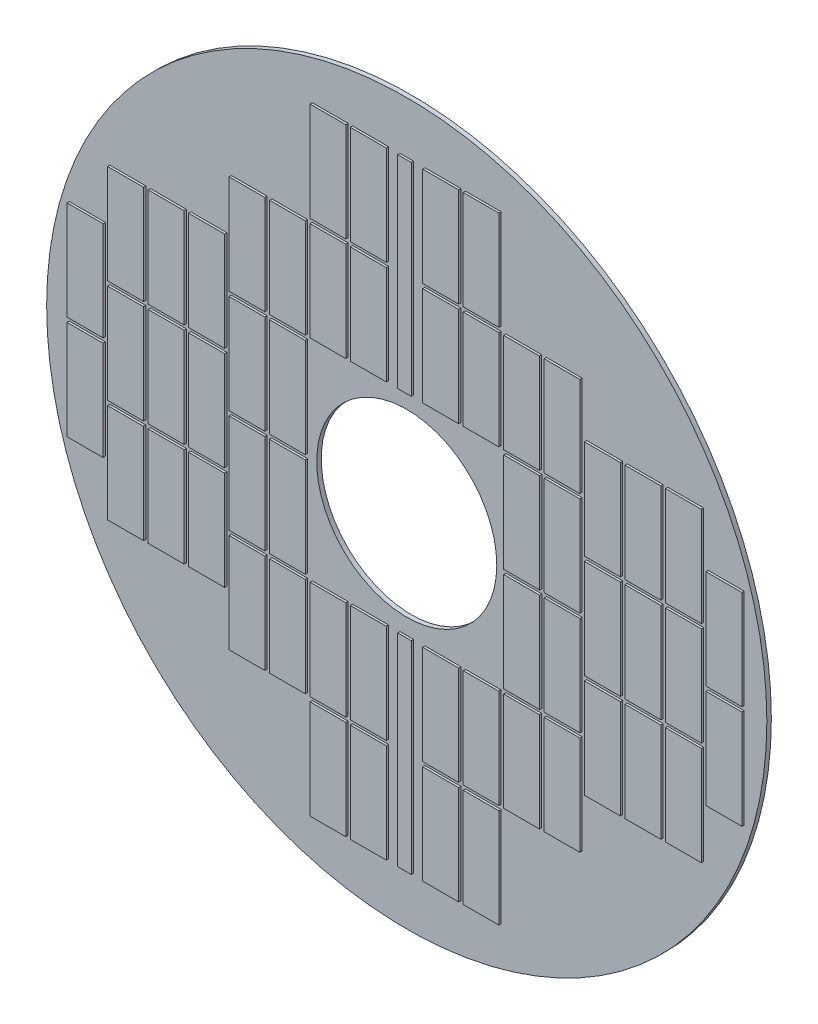
from build123d import *

# Parameters (mm, degrees)
SKETCH_1_R      = 800
SKETCH_1_R_2    = 200
EXTRUDE_1_DEPTH = 10
SKETCH_2_W      = 80
SKETCH_2_H      = 220
SKETCH_2_W_2    = 79.242685904
EXTRUDE_2_DEPTH = 15
SKETCH_3_W      = 30
SKETCH_3_H      = 450
EXTRUDE_3_DEPTH = 15


with BuildPart() as part:
    # 草图1 → 凸台-拉伸1 (new body)
    with BuildSketch(Plane.XY):
        Circle(SKETCH_1_R)
        Circle(SKETCH_1_R_2, mode=Mode.SUBTRACT)
    extrude(amount=EXTRUDE_1_DEPTH)

    # 草图2 → 凸台-拉伸2 (add)
    with BuildSketch(Plane.XY):
        with Locations((709.692901867, 115)):
            Rectangle(SKETCH_2_W, SKETCH_2_H)
        with Locations((619.692901867, 0)):
            Rectangle(SKETCH_2_W, SKETCH_2_H)
        with Locations((529.692901867, 0)):
            Rectangle(SKETCH_2_W, SKETCH_2_H)
        with Locations((439.692901867, 0)):
            Rectangle(SKETCH_2_W, SKETCH_2_H)
        with Locations((619.692901867, 230)):
            Rectangle(SKETCH_2_W, SKETCH_2_H)
        with Locations((529.692901867, 230)):
            Rectangle(SKETCH_2_W, SKETCH_2_H)
        with Locations((439.692901867, 230)):
            Rectangle(SKETCH_2_W, SKETCH_2_H)
        with Locations((350.071558915, 115)):
            Rectangle(SKETCH_2_W_2, SKETCH_2_H)
        with Locations((260.450215963, 115)):
            Rectangle(SKETCH_2_W, SKETCH_2_H)
        with Locations((350.071558915, 345)):
            Rectangle(SKETCH_2_W_2, SKETCH_2_H)
        with Locations((260.071558915, 345)):
            Rectangle(SKETCH_2_W_2, SKETCH_2_H)
        with Locations((170.071558915, 345)):
            Rectangle(SKETCH_2_W_2, SKETCH_2_H)
        with Locations((80.450215963, 345)):
            Rectangle(SKETCH_2_W, SKETCH_2_H)
        with Locations((170.071558915, 575)):
            Rectangle(SKETCH_2_W_2, SKETCH_2_H)
        with Locations((80.450215963, 575)):
            Rectangle(SKETCH_2_W, SKETCH_2_H)
        with Locations((170.071558915, -575)):
            Rectangle(SKETCH_2_W_2, SKETCH_2_H)
        with Locations((80.450215963, -575)):
            Rectangle(SKETCH_2_W, SKETCH_2_H)
        with Locations((80.450215963, -345)):
            Rectangle(SKETCH_2_W, SKETCH_2_H)
        with Locations((170.071558915, -345)):
            Rectangle(SKETCH_2_W_2, SKETCH_2_H)
        with Locations((260.071558915, -345)):
            Rectangle(SKETCH_2_W_2, SKETCH_2_H)
        with Locations((350.071558915, -345)):
            Rectangle(SKETCH_2_W_2, SKETCH_2_H)
        with Locations((709.692901867, -115)):
            Rectangle(SKETCH_2_W, SKETCH_2_H)
        with Locations((619.692901867, -230)):
            Rectangle(SKETCH_2_W, SKETCH_2_H)
        with Locations((529.692901867, -230)):
            Rectangle(SKETCH_2_W, SKETCH_2_H)
        with Locations((439.692901867, -230)):
            Rectangle(SKETCH_2_W, SKETCH_2_H)
        with Locations((350.071558915, -115)):
            Rectangle(SKETCH_2_W_2, SKETCH_2_H)
        with Locations((260.450215963, -115)):
            Rectangle(SKETCH_2_W, SKETCH_2_H)
        with Locations((-260.450215963, -115)):
            Rectangle(SKETCH_2_W, SKETCH_2_H)
        with Locations((-350.071558915, -115)):
            Rectangle(SKETCH_2_W_2, SKETCH_2_H)
        with Locations((-439.692901867, -230)):
            Rectangle(SKETCH_2_W, SKETCH_2_H)
        with Locations((-529.692901867, -230)):
            Rectangle(SKETCH_2_W, SKETCH_2_H)
        with Locations((-619.692901867, -230)):
            Rectangle(SKETCH_2_W, SKETCH_2_H)
        with Locations((-709.692901867, -115)):
            Rectangle(SKETCH_2_W, SKETCH_2_H)
        with Locations((-350.071558915, -345)):
            Rectangle(SKETCH_2_W_2, SKETCH_2_H)
        with Locations((-260.071558915, -345)):
            Rectangle(SKETCH_2_W_2, SKETCH_2_H)
        with Locations((-170.071558915, -345)):
            Rectangle(SKETCH_2_W_2, SKETCH_2_H)
        with Locations((-80.450215963, -345)):
            Rectangle(SKETCH_2_W, SKETCH_2_H)
        with Locations((-80.450215963, -575)):
            Rectangle(SKETCH_2_W, SKETCH_2_H)
        with Locations((-170.071558915, -575)):
            Rectangle(SKETCH_2_W_2, SKETCH_2_H)
        with Locations((-80.450215963, 575)):
            Rectangle(SKETCH_2_W, SKETCH_2_H)
        with Locations((-170.071558915, 575)):
            Rectangle(SKETCH_2_W_2, SKETCH_2_H)
        with Locations((-170.071558915, 345)):
            Rectangle(SKETCH_2_W_2, SKETCH_2_H)
        with Locations((-80.450215963, 345)):
            Rectangle(SKETCH_2_W, SKETCH_2_H)
        with Locations((-260.071558915, 345)):
            Rectangle(SKETCH_2_W_2, SKETCH_2_H)
        with Locations((-350.071558915, 345)):
            Rectangle(SKETCH_2_W_2, SKETCH_2_H)
        with Locations((-260.450215963, 115)):
            Rectangle(SKETCH_2_W, SKETCH_2_H)
        with Locations((-350.071558915, 115)):
            Rectangle(SKETCH_2_W_2, SKETCH_2_H)
        with Locations((-439.692901867, 230)):
            Rectangle(SKETCH_2_W, SKETCH_2_H)
        with Locations((-529.692901867, 230)):
            Rectangle(SKETCH_2_W, SKETCH_2_H)
        with Locations((-619.692901867, 230)):
            Rectangle(SKETCH_2_W, SKETCH_2_H)
        with Locations((-439.692901867, 0)):
            Rectangle(SKETCH_2_W, SKETCH_2_H)
        with Locations((-529.692901867, 0)):
            Rectangle(SKETCH_2_W, SKETCH_2_H)
        with Locations((-619.692901867, 0)):
            Rectangle(SKETCH_2_W, SKETCH_2_H)
        with Locations((-709.692901867, 115)):
            Rectangle(SKETCH_2_W, SKETCH_2_H)
    extrude(amount=EXTRUDE_2_DEPTH)

    # 草图3 → 凸台-拉伸3 (add)
    with BuildSketch(Plane.XY):
        with Locations((0, 460)):
            Rectangle(SKETCH_3_W, SKETCH_3_H)
        with Locations((0, -460)):
            Rectangle(SKETCH_3_W, SKETCH_3_H)
    extrude(amount=EXTRUDE_3_DEPTH)


solid = part.part
